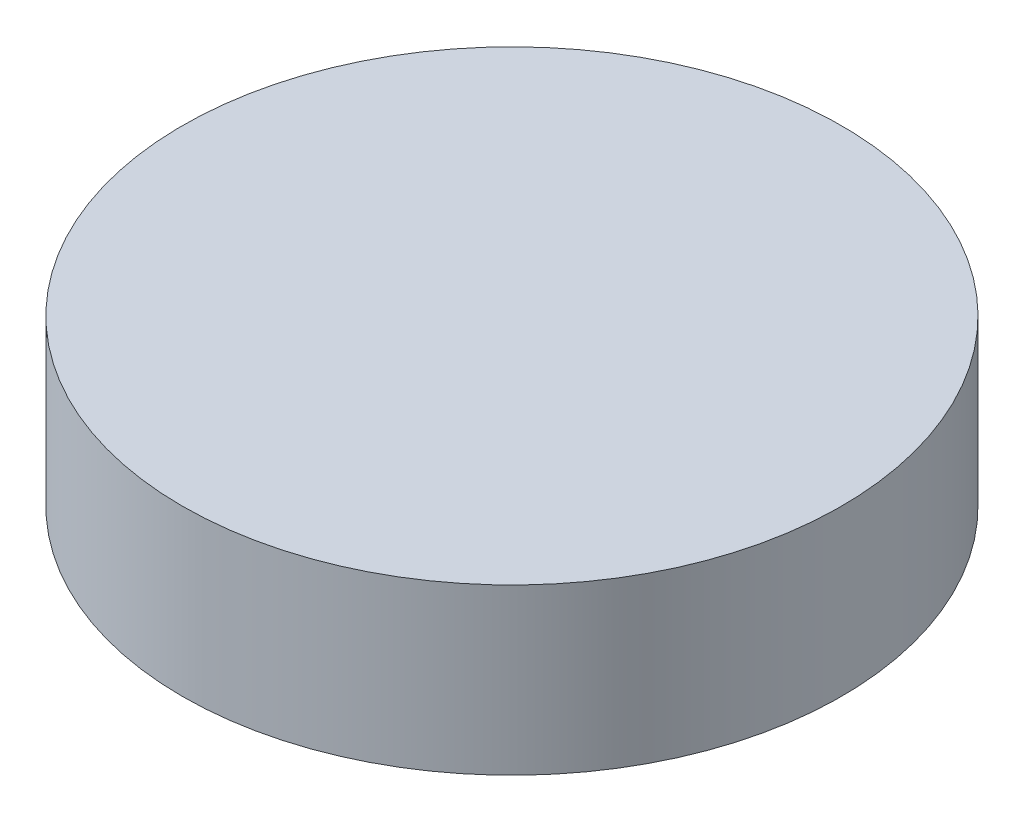
from build123d import *

# Parameters (mm, degrees)
SKETCH1_R           = 2
BOSS_EXTRUDE1_DEPTH = 1


with BuildPart() as part:
    # Sketch1 → Boss-Extrude1 (new body)
    with BuildSketch(Plane(origin=(0, 0, 0), x_dir=(1, 0, 0), z_dir=(0, 1, 0))):
        with Locations(Location((-2.041136573, 0.184966703, 0), (0, 0, 270))):
            Circle(SKETCH1_R)
    extrude(amount=BOSS_EXTRUDE1_DEPTH)


solid = part.part
